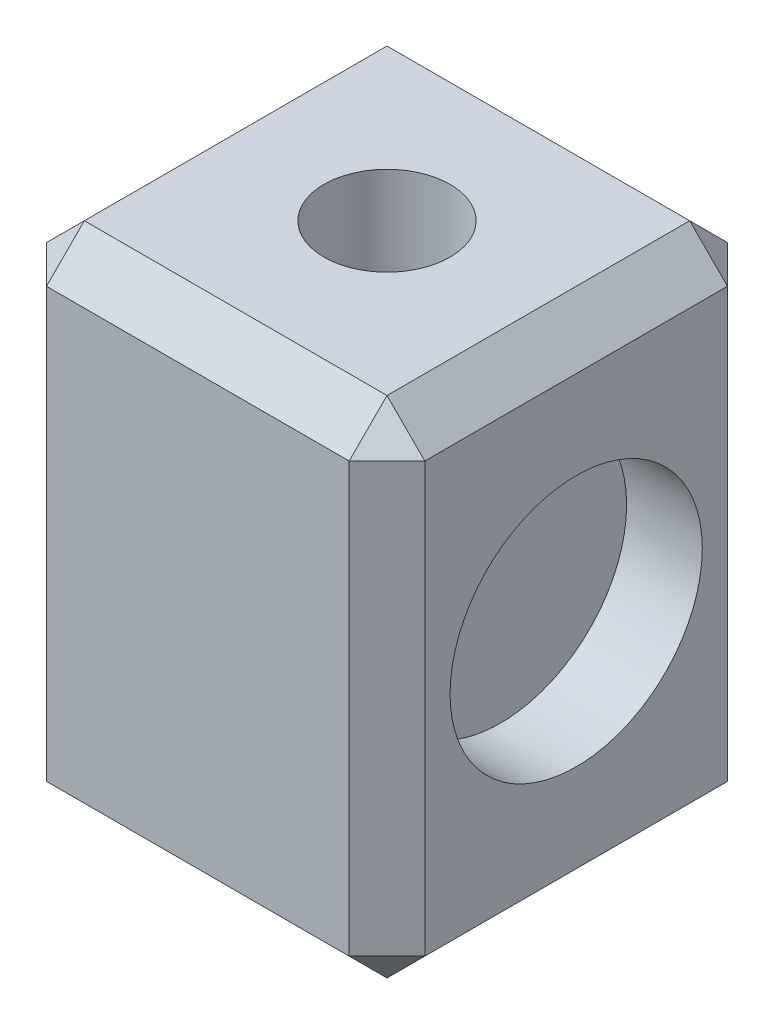
from build123d import *

# Parameters (mm, degrees)
SKETCH1_W           = 38.1
SKETCH1_H           = 38.1
SKETCH1_R           = 6.35
BOSS_EXTRUDE1_DEPTH = 50.8
CUT_EXTRUDE1_START  = 19.05
SKETCH2_R           = 12.7
CUT_EXTRUDE1_DEPTH  = 7.62
CUT_EXTRUDE2_START  = -11.43
SKETCH2_2_R         = 12.7
CUT_EXTRUDE2_DEPTH  = 7.62
CHAMFER1_SIZE       = 3.81


with BuildPart() as part:
    # Sketch1 → Boss-Extrude1 (new body)
    with BuildSketch(Plane(origin=(0, 0, 0), x_dir=(1, 0, 0), z_dir=(0, 1, 0))):
        Rectangle(SKETCH1_W, SKETCH1_H)
        with Locations(Location((0, 0, 0), (0, 0, 270))):
            Circle(SKETCH1_R, mode=Mode.SUBTRACT)
    extrude(amount=BOSS_EXTRUDE1_DEPTH)

    # Sketch2 → Cut-Extrude1 (cut)
    with BuildSketch(Plane(origin=(0, 0, 0), x_dir=(0, 0, -1), z_dir=(1, 0, 0)).offset(CUT_EXTRUDE1_START)):
        with Locations((0, 25.4)):
            Circle(SKETCH2_R)
    extrude(amount=-CUT_EXTRUDE1_DEPTH, mode=Mode.SUBTRACT)

    # Sketch2<2> → Cut-Extrude2 (cut)
    with BuildSketch(Plane(origin=(0, 0, 0), x_dir=(0, 0, -1), z_dir=(1, 0, 0)).offset(CUT_EXTRUDE2_START)):
        with Locations((0, 25.4)):
            Circle(SKETCH2_2_R)
    extrude(amount=-CUT_EXTRUDE2_DEPTH, mode=Mode.SUBTRACT)

    # Chamfer1
    chamfer1_edges = [part.edges().sort_by_distance(p)[0] for p in [
        (-19.05, 50.8, 0),
        (0, 50.8, 19.05),
        (19.05, 50.8, 0),
        (0, 0, 19.05),
        (-19.05, 0, 0),
        (0, 0, -19.05),
        (19.05, 0, 0),
        (19.05, 25.4, 19.05),
        (-19.05, 25.4, 19.05),
        (-19.05, 25.4, -19.05),
        (19.05, 25.4, -19.05),
        (0, 50.8, -19.05),
    ]]
    chamfer(chamfer1_edges, length=CHAMFER1_SIZE)


solid = part.part
